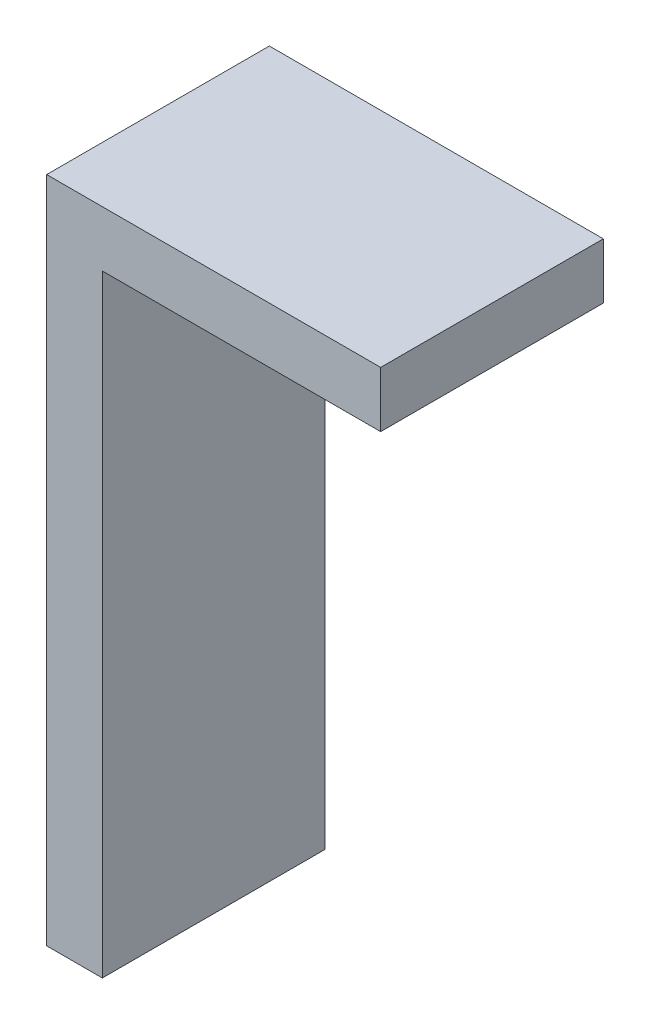
from build123d import *

# Parameters (mm, degrees)
SKETCH2_W           = 6.35
SKETCH2_H           = 25.4
BOSS_EXTRUDE1_DEPTH = 76.2
SKETCH3_W           = 25.4
SKETCH3_H           = 6.35
BOSS_EXTRUDE3_DEPTH = 31.75


with BuildPart() as part:
    # Sketch2 → Boss-Extrude1 (new body)
    with BuildSketch(Plane(origin=(0, 0, 0), x_dir=(1, 0, 0), z_dir=(0, 1, 0))):
        Rectangle(SKETCH2_W, SKETCH2_H)
    extrude(amount=BOSS_EXTRUDE1_DEPTH)

    # Sketch3 → Boss-Extrude3 (add)
    with BuildSketch(Plane(origin=(3.175, 0, 0), x_dir=(0, 0, -1), z_dir=(1, 0, 0))):
        with Locations((0, 73.025)):
            Rectangle(SKETCH3_W, SKETCH3_H)
    extrude(amount=BOSS_EXTRUDE3_DEPTH)


solid = part.part
